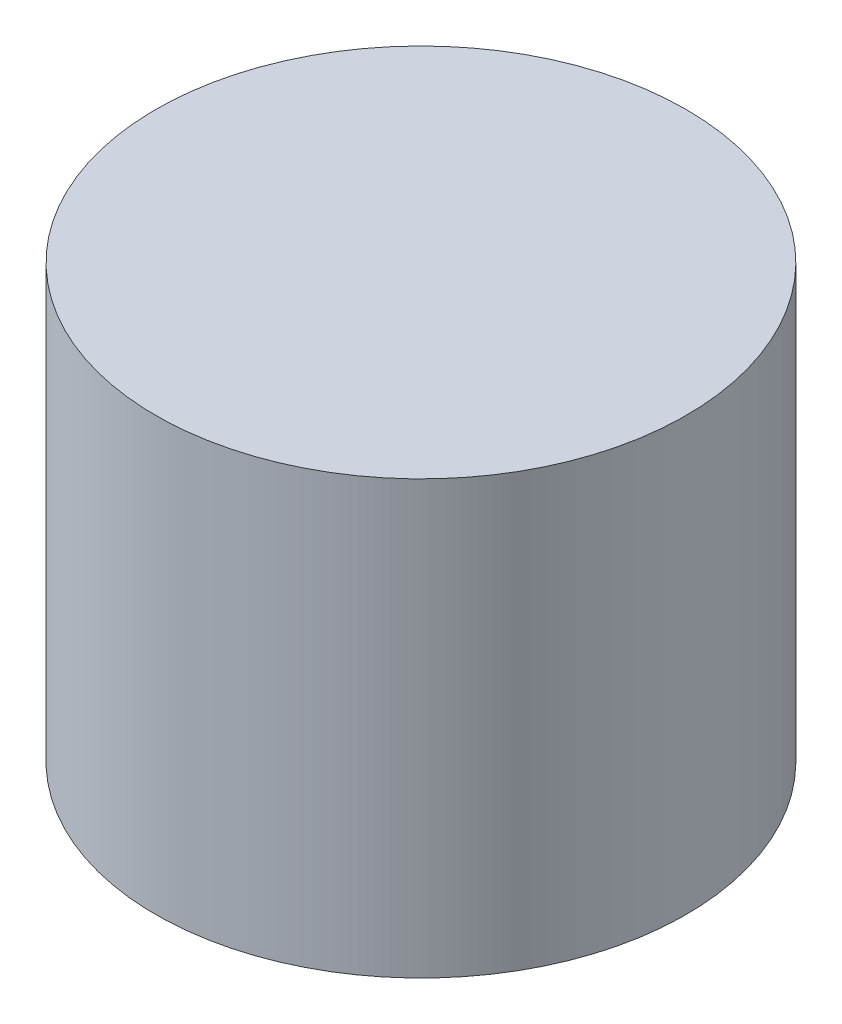
from build123d import *

# Parameters (mm, degrees)
SKETCH1_R           = 37.5
BOSS_EXTRUDE1_DEPTH = 61.15


with BuildPart() as part:
    # Sketch1 → Boss-Extrude1 (new body)
    with BuildSketch(Plane(origin=(0, 0, 0), x_dir=(1, 0, 0), z_dir=(0, 1, 0))):
        with Locations(Location((0, 0, 0), (0, 0, 90))):
            Circle(SKETCH1_R)
    extrude(amount=BOSS_EXTRUDE1_DEPTH)


solid = part.part
